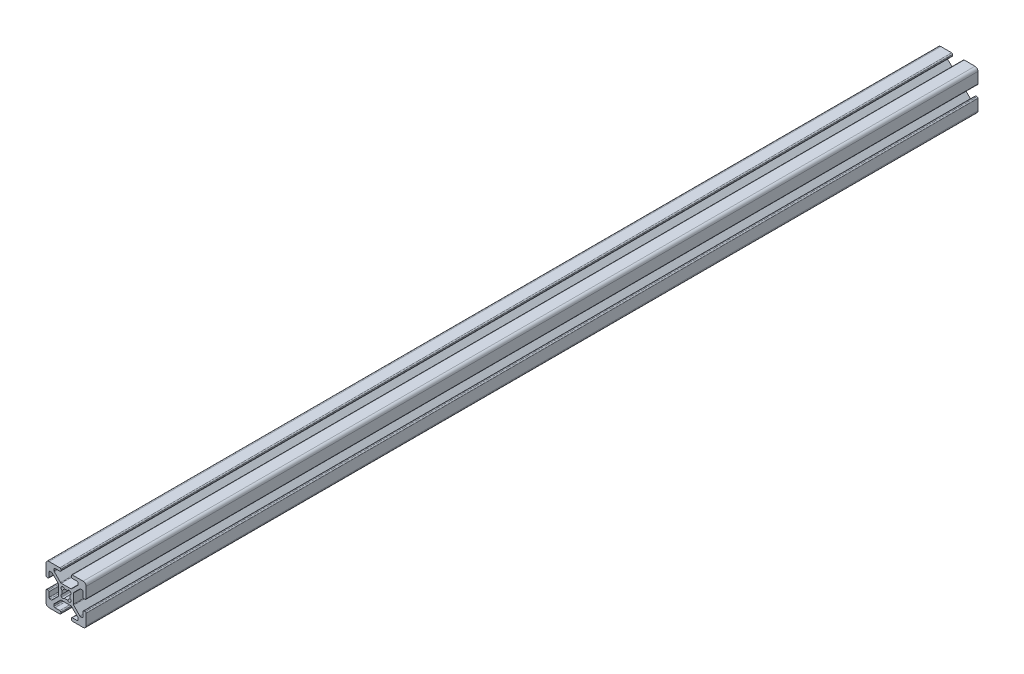
from build123d import *

# Parameters (mm, degrees)
EXTRUDE1_DEPTH = 445


with BuildPart() as part:
    # Sketch1 → Extrude1 (new body)
    with BuildSketch(Plane.XY):
        with BuildLine():
            Line((9.492, 2.63), (9.008, 2.63))
            ThreePointArc((9.008, 2.63), (8.648789755, 2.778789755), (8.5, 3.138))
            Line((8.5, 3.138), (8.5, 5.487))
            ThreePointArc((8.5, 5.487), (8.351210245, 5.846210245), (7.992, 5.995))
            Line((7.992, 5.995), (7.266080661, 5.995))
            ThreePointArc((7.266080661, 5.995), (7.071677478, 5.956330803), (6.906870417, 5.846210245))
            Line((6.906870417, 5.846210245), (3.803789755, 2.743129583))
            ThreePointArc((3.803789755, 2.743129583), (3.693669197, 2.578322522), (3.655, 2.383919339))
            Line((3.655, 2.383919339), (3.655, -2.383919339))
            ThreePointArc((3.655, -2.383919339), (3.693669197, -2.578322522), (3.803789755, -2.743129583))
            Line((3.803789755, -2.743129583), (6.906870417, -5.846210245))
            ThreePointArc((6.906870417, -5.846210245), (7.071677478, -5.956330803), (7.266080661, -5.995))
            Line((7.266080661, -5.995), (7.992, -5.995))
            ThreePointArc((7.992, -5.995), (8.351210245, -5.846210245), (8.5, -5.487))
            Line((8.5, -5.487), (8.5, -3.138))
            ThreePointArc((8.5, -3.138), (8.648789755, -2.778789755), (9.008, -2.63))
            Line((9.008, -2.63), (9.492, -2.63))
            ThreePointArc((9.492, -2.63), (9.851210245, -2.778789755), (10, -3.138))
            Line((10, -3.138), (10, -8.5))
            ThreePointArc((10, -8.5), (9.560660172, -9.560660172), (8.5, -10))
            Line((8.5, -10), (3.138, -10))
            ThreePointArc((3.138, -10), (2.778789755, -9.851210245), (2.63, -9.492))
            Line((2.63, -9.492), (2.63, -9.008))
            ThreePointArc((2.63, -9.008), (2.778789755, -8.648789755), (3.138, -8.5))
            Line((3.138, -8.5), (5.487, -8.5))
            ThreePointArc((5.487, -8.5), (5.846210245, -8.351210245), (5.995, -7.992))
            Line((5.995, -7.992), (5.995, -7.266080661))
            ThreePointArc((5.995, -7.266080661), (5.956330803, -7.071677478), (5.846210245, -6.906870417))
            Line((5.846210245, -6.906870417), (2.743129583, -3.803789755))
            ThreePointArc((2.743129583, -3.803789755), (2.578322522, -3.693669197), (2.383919339, -3.655))
            Line((2.383919339, -3.655), (-2.383919339, -3.655))
            ThreePointArc((-2.383919339, -3.655), (-2.578322522, -3.693669197), (-2.743129583, -3.803789755))
            Line((-2.743129583, -3.803789755), (-5.846210245, -6.906870417))
            ThreePointArc((-5.846210245, -6.906870417), (-5.956330803, -7.071677478), (-5.995, -7.266080661))
            Line((-5.995, -7.266080661), (-5.995, -7.992))
            ThreePointArc((-5.995, -7.992), (-5.846210245, -8.351210245), (-5.487, -8.5))
            Line((-5.487, -8.5), (-3.138, -8.5))
            ThreePointArc((-3.138, -8.5), (-2.778789755, -8.648789755), (-2.63, -9.008))
            Line((-2.63, -9.008), (-2.63, -9.492))
            ThreePointArc((-2.63, -9.492), (-2.778789755, -9.851210245), (-3.138, -10))
            Line((-3.138, -10), (-8.5, -10))
            ThreePointArc((-8.5, -10), (-9.560660172, -9.560660172), (-10, -8.5))
            Line((-10, -8.5), (-10, -3.138))
            ThreePointArc((-10, -3.138), (-9.851210245, -2.778789755), (-9.492, -2.63))
            Line((-9.492, -2.63), (-9.008, -2.63))
            ThreePointArc((-9.008, -2.63), (-8.648789755, -2.778789755), (-8.5, -3.138))
            Line((-8.5, -3.138), (-8.5, -5.487))
            ThreePointArc((-8.5, -5.487), (-8.351210245, -5.846210245), (-7.992, -5.995))
            Line((-7.992, -5.995), (-7.266080661, -5.995))
            ThreePointArc((-7.266080661, -5.995), (-7.071677478, -5.956330803), (-6.906870417, -5.846210245))
            Line((-6.906870417, -5.846210245), (-3.803789755, -2.743129583))
            ThreePointArc((-3.803789755, -2.743129583), (-3.693669197, -2.578322522), (-3.655, -2.383919339))
            Line((-3.655, -2.383919339), (-3.655, 2.383919339))
            ThreePointArc((-3.655, 2.383919339), (-3.693669197, 2.578322522), (-3.803789755, 2.743129583))
            Line((-3.803789755, 2.743129583), (-6.906870417, 5.846210245))
            ThreePointArc((-6.906870417, 5.846210245), (-7.071677478, 5.956330803), (-7.266080661, 5.995))
            Line((-7.266080661, 5.995), (-7.992, 5.995))
            ThreePointArc((-7.992, 5.995), (-8.351210245, 5.846210245), (-8.5, 5.487))
            Line((-8.5, 5.487), (-8.5, 3.138))
            ThreePointArc((-8.5, 3.138), (-8.648789755, 2.778789755), (-9.008, 2.63))
            Line((-9.008, 2.63), (-9.492, 2.63))
            ThreePointArc((-9.492, 2.63), (-9.851210245, 2.778789755), (-10, 3.138))
            Line((-10, 3.138), (-10, 8.5))
            ThreePointArc((-10, 8.5), (-9.560660172, 9.560660172), (-8.5, 10))
            Line((-8.5, 10), (-3.138, 10))
            ThreePointArc((-3.138, 10), (-2.778789755, 9.851210245), (-2.63, 9.492))
            Line((-2.63, 9.492), (-2.63, 9.008))
            ThreePointArc((-2.63, 9.008), (-2.778789755, 8.648789755), (-3.138, 8.5))
            Line((-3.138, 8.5), (-5.487, 8.5))
            ThreePointArc((-5.487, 8.5), (-5.846210245, 8.351210245), (-5.995, 7.992))
            Line((-5.995, 7.992), (-5.995, 7.266080661))
            ThreePointArc((-5.995, 7.266080661), (-5.956330803, 7.071677478), (-5.846210245, 6.906870417))
            Line((-5.846210245, 6.906870417), (-2.743129583, 3.803789755))
            ThreePointArc((-2.743129583, 3.803789755), (-2.578322522, 3.693669197), (-2.383919339, 3.655))
            Line((-2.383919339, 3.655), (2.383919339, 3.655))
            ThreePointArc((2.383919339, 3.655), (2.578322522, 3.693669197), (2.743129583, 3.803789755))
            Line((2.743129583, 3.803789755), (5.846210245, 6.906870417))
            ThreePointArc((5.846210245, 6.906870417), (5.956330803, 7.071677478), (5.995, 7.266080661))
            Line((5.995, 7.266080661), (5.995, 7.992))
            ThreePointArc((5.995, 7.992), (5.846210245, 8.351210245), (5.487, 8.5))
            Line((5.487, 8.5), (3.138, 8.5))
            ThreePointArc((3.138, 8.5), (2.778789755, 8.648789755), (2.63, 9.008))
            Line((2.63, 9.008), (2.63, 9.492))
            ThreePointArc((2.63, 9.492), (2.778789755, 9.851210245), (3.138, 10))
            Line((3.138, 10), (8.5, 10))
            ThreePointArc((8.5, 10), (9.560660172, 9.560660172), (10, 8.5))
            Line((10, 8.5), (10, 3.138))
            ThreePointArc((10, 3.138), (9.851210245, 2.778789755), (9.492, 2.63))
        make_face()
        with BuildLine():
            Line((2.124900844, -2.304505966), (2.304505966, -2.124900844))
            ThreePointArc((2.304505966, -2.124900844), (2.505938017, -1.356467811), (1.935133506, -0.803976718))
            ThreePointArc((1.935133506, -0.803976718), (2.0955, 0), (1.935133506, 0.803976718))
            ThreePointArc((1.935133506, 0.803976718), (2.505938017, 1.356467811), (2.304505966, 2.124900844))
            Line((2.304505966, 2.124900844), (2.124900844, 2.304505966))
            ThreePointArc((2.124900844, 2.304505966), (1.356467811, 2.505938017), (0.803976718, 1.935133506))
            ThreePointArc((0.803976718, 1.935133506), (0, 2.0955), (-0.803976718, 1.935133506))
            ThreePointArc((-0.803976718, 1.935133506), (-1.356467811, 2.505938017), (-2.124900844, 2.304505966))
            Line((-2.124900844, 2.304505966), (-2.304505966, 2.124900844))
            ThreePointArc((-2.304505966, 2.124900844), (-2.505938017, 1.356467811), (-1.935133506, 0.803976718))
            ThreePointArc((-1.935133506, 0.803976718), (-2.0955, 0), (-1.935133506, -0.803976718))
            ThreePointArc((-1.935133506, -0.803976718), (-2.505938017, -1.356467811), (-2.304505966, -2.124900844))
            Line((-2.304505966, -2.124900844), (-2.124900844, -2.304505966))
            ThreePointArc((-2.124900844, -2.304505966), (-1.356467811, -2.505938017), (-0.803976718, -1.935133506))
            ThreePointArc((-0.803976718, -1.935133506), (0, -2.0955), (0.803976718, -1.935133506))
            ThreePointArc((0.803976718, -1.935133506), (1.356467811, -2.505938017), (2.124900844, -2.304505966))
        make_face(mode=Mode.SUBTRACT)
    extrude(amount=-EXTRUDE1_DEPTH)


solid = part.part
